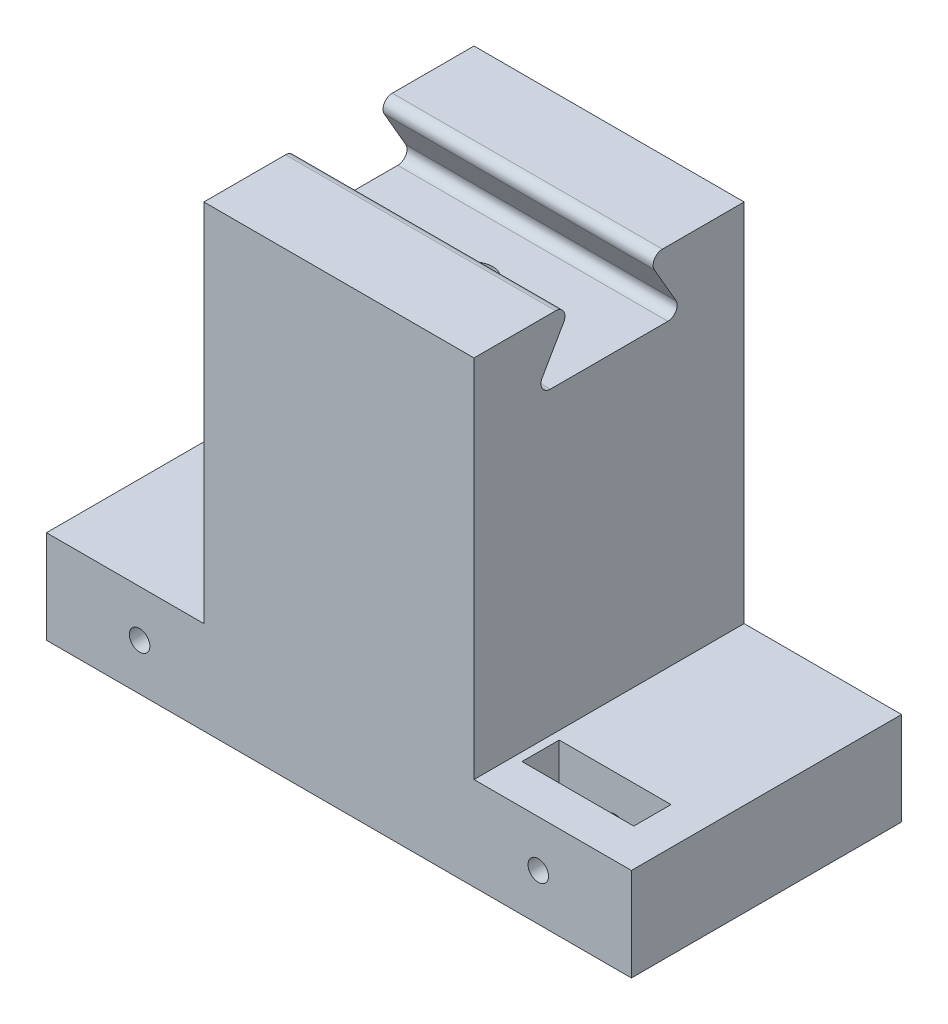
from build123d import *

# Parameters (mm, degrees)
SKETCH1_W           = 14.5
SKETCH1_H           = 14.5
BOSS_EXTRUDE1_DEPTH = 24.6
CUT_EXTRUDE1_DEPTH  = 10
SKETCH4_R           = 4
BOSS_EXTRUDE2_DEPTH = 2
FILLET1_R           = 0.5
SKETCH6_W           = 8.45
SKETCH6_H           = 14.5
BOSS_EXTRUDE3_DEPTH = 5
SKETCH7_W           = 6
SKETCH7_H           = 2
CUT_EXTRUDE2_DEPTH  = 5
SKETCH8_R           = 0.55
CUT_EXTRUDE3_DEPTH  = 33.586807146
SKETCH9_R           = 1
CUT_EXTRUDE4_DEPTH  = 29.855891946


with BuildPart() as part:
    # Sketch1 → Boss-Extrude1 (new body)
    with BuildSketch(Plane(origin=(0, 0, 0), x_dir=(1, 0, 0), z_dir=(0, 1, 0))):
        Rectangle(SKETCH1_W, SKETCH1_H)
    extrude(amount=BOSS_EXTRUDE1_DEPTH)

    # Sketch2 → Cut-Extrude1 (cut, symmetric)
    with BuildSketch(Plane(origin=(0, 0, 0), x_dir=(0, 0, -1), z_dir=(1, 0, 0))):
        Polygon((-2, 24.6), (2, 24.6), (4.020725942, 21.1), (-4.020725942, 21.1), align=None)
    extrude(amount=CUT_EXTRUDE1_DEPTH, both=True, mode=Mode.SUBTRACT)

    # Sketch4 → Boss-Extrude2 (add)
    with BuildSketch(Plane.XZ):
        with Locations(Location((0, 0, 0), (0, 0, 270))):
            Circle(SKETCH4_R)
    extrude(amount=BOSS_EXTRUDE2_DEPTH)

    # Sketch3 → Cut-Revolve1 (revolve, cut)
    with BuildSketch(Plane(origin=(0, 0, 0), x_dir=(0, 0, -1), z_dir=(1, 0, 0))):
        with BuildLine():
            Line((3.302, 0), (3.302, -3.302))
            Line((3.302, -3.302), (0, -3.302))
            Line((0, -3.302), (0, 0))
            Line((0, 0), (0, 3.302))
            ThreePointArc((0, 3.302), (2.334866591, 2.334866591), (3.302, 0))
        make_face()
    revolve(axis=Axis((0, 0, 0), (0, 1, 0)), mode=Mode.SUBTRACT)

    # Fillet1
    fillet1_edges = [part.edges().sort_by_distance(p)[0] for p in [
        (0, 24.6, 2),
        (0, 24.6, -2),
        (0, 21.1, -4.020725942),
        (0, 21.1, 4.020725942),
    ]]
    fillet(fillet1_edges, radius=FILLET1_R)

    # Sketch6 → Boss-Extrude3 (add)
    with BuildSketch(Plane(origin=(0, 0, 0), x_dir=(1, 0, 0), z_dir=(0, 1, 0))):
        with Locations((11.475, 0)):
            Rectangle(SKETCH6_W, SKETCH6_H)
        with Locations((-11.475, 0)):
            Rectangle(SKETCH6_W, SKETCH6_H)
    extrude(amount=BOSS_EXTRUDE3_DEPTH)

    # Sketch7 → Cut-Extrude2 (cut)
    with BuildSketch(Plane.XZ):
        with Locations((10.7, 4.125)):
            Rectangle(SKETCH7_W, SKETCH7_H)
        with Locations((-10.7, -4.125)):
            Rectangle(SKETCH7_W, SKETCH7_H)
    extrude(amount=-CUT_EXTRUDE2_DEPTH, mode=Mode.SUBTRACT)

    # Sketch8 → Cut-Extrude3 (cut, through all)
    with BuildSketch(Plane(origin=(0, 0, -7.25), x_dir=(-1, 0, 0), z_dir=(0, 0, -1))):
        with Locations((-10.7, 2.5)):
            Circle(SKETCH8_R)
        with Locations((10.7, 2.5)):
            Circle(SKETCH8_R)
    extrude(amount=-CUT_EXTRUDE3_DEPTH, mode=Mode.SUBTRACT)

    # Sketch9 → Cut-Extrude4 (cut, through all)
    with BuildSketch(Plane(origin=(0, 21.1, 0), x_dir=(1, 0, 0), z_dir=(0, 1, 0))):
        with Locations(Location((0, 0, 0), (0, 0, 270))):
            Circle(SKETCH9_R)
    extrude(amount=-CUT_EXTRUDE4_DEPTH, mode=Mode.SUBTRACT)


solid = part.part
